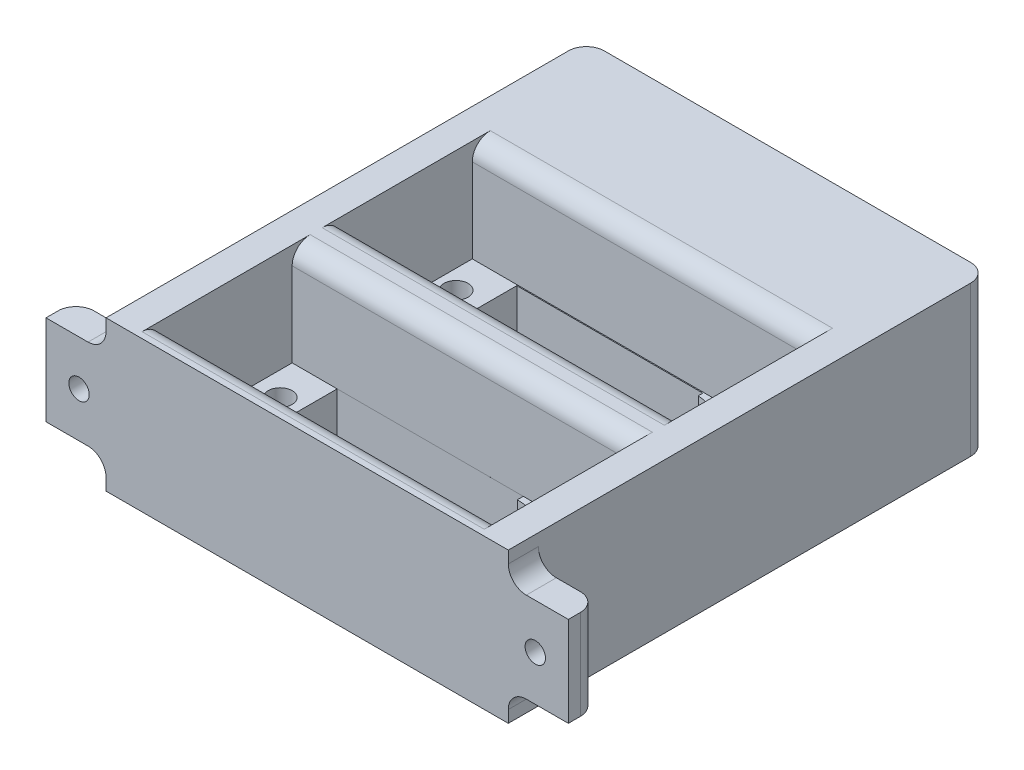
from build123d import *

# Parameters (mm, degrees)
SKETCH1_W           = 67
SKETCH1_H           = 30
BOSS_EXTRUDE1_DEPTH = 25
SKETCH2_W           = 57
SKETCH2_H           = 22
CUT_EXTRUDE1_DEPTH  = 17
SKETCH3_R           = 10
SKETCH3_R_2         = 8
SKETCH3_R_3         = 2
CUT_EXTRUDE2_DEPTH  = 8
BOSS_EXTRUDE2_START = -67
SKETCH4_W           = 5
SKETCH4_H           = 15
BOSS_EXTRUDE2_DEPTH = 10
SKETCH4_2_W         = 5
SKETCH4_2_H         = 15
BOSS_EXTRUDE3_DEPTH = 10
SKETCH5_R           = 1.7
CUT_EXTRUDE3_DEPTH  = 10
CUT_EXTRUDE4_DEPTH  = 8
SKETCH8_W           = 67
SKETCH8_H           = 25
BOSS_EXTRUDE4_DEPTH = 50
SKETCH9_W           = 57
SKETCH9_H           = 22
CUT_EXTRUDE6_DEPTH  = 17
SKETCH11_R          = 10
SKETCH11_R_2        = 8
SKETCH11_R_3        = 2
CUT_EXTRUDE7_DEPTH  = 81.039052968
CUT_EXTRUDE8_DEPTH  = 81.039052968
FILLET1_R           = 3


with BuildPart() as part:
    # Sketch1 → Boss-Extrude1 (new body)
    with BuildSketch(Plane(origin=(0, 0, 0), x_dir=(1, 0, 0), z_dir=(0, 1, 0))):
        Rectangle(SKETCH1_W, SKETCH1_H)
    extrude(amount=BOSS_EXTRUDE1_DEPTH)

    # Sketch2 → Cut-Extrude1 (cut)
    with BuildSketch(Plane(origin=(0, 25, 0), x_dir=(1, 0, 0), z_dir=(0, 1, 0))):
        Rectangle(SKETCH2_W, SKETCH2_H)
    extrude(amount=-CUT_EXTRUDE1_DEPTH, mode=Mode.SUBTRACT)

    # Sketch3 → Cut-Extrude2 (cut)
    with BuildSketch(Plane(origin=(0, 8, 0), x_dir=(1, 0, 0), z_dir=(0, 1, 0))):
        with Locations((10, 0)):
            Circle(SKETCH3_R)
        with Locations((-3, 0)):
            Circle(SKETCH3_R_2)
        with Locations(Location((-24.5, 5, 0), (0, 0, 270))):
            Circle(SKETCH3_R_3)
        with Locations(Location((-24.5, -5, 0), (0, 0, 270))):
            Circle(SKETCH3_R_3)
        with Locations(Location((24.5, 5, 0), (0, 0, 270))):
            Circle(SKETCH3_R_3)
        with Locations(Location((24.5, -5, 0), (0, 0, 270))):
            Circle(SKETCH3_R_3)
    extrude(amount=-CUT_EXTRUDE2_DEPTH, mode=Mode.SUBTRACT)

    # Sketch4 → Boss-Extrude2 (add)
    with BuildSketch(Plane(origin=(33.5, 0, 0), x_dir=(0, 0, -1), z_dir=(1, 0, 0)).offset(BOSS_EXTRUDE2_START)):
        with Locations((-12.5, 12.5)):
            Rectangle(SKETCH4_W, SKETCH4_H)
    extrude(amount=-BOSS_EXTRUDE2_DEPTH)

    # Sketch4<2> → Boss-Extrude3 (add)
    with BuildSketch(Plane(origin=(33.5, 0, 0), x_dir=(0, 0, -1), z_dir=(1, 0, 0))):
        with Locations((-12.5, 12.5)):
            Rectangle(SKETCH4_2_W, SKETCH4_2_H)
    extrude(amount=BOSS_EXTRUDE3_DEPTH)

    # Sketch5 → Cut-Extrude3 (cut)
    with BuildSketch(Plane(origin=(0, 0, 10), x_dir=(-1, 0, 0), z_dir=(0, 0, -1))):
        with Locations(Location((38, 12.5, 0), (0, 0, 90))):
            Circle(SKETCH5_R)
        with Locations(Location((-38, 12.5, 0), (0, 0, 90))):
            Circle(SKETCH5_R)
    extrude(amount=-CUT_EXTRUDE3_DEPTH, mode=Mode.SUBTRACT)

    # Sketch6 → Cut-Extrude4 (cut)
    with BuildSketch(Plane(origin=(0, 8, 0), x_dir=(1, 0, 0), z_dir=(0, 1, 0))):
        Polygon((-21, 11.00455557), (-21.003329437, -10.997477388), (10, -11.002168937), (10, 10.997831063), align=None)
    extrude(amount=-CUT_EXTRUDE4_DEPTH, mode=Mode.SUBTRACT)

    # Sketch8 → Boss-Extrude4 (add)
    with BuildSketch(Plane(origin=(0, 0, -15), x_dir=(-1, 0, 0), z_dir=(0, 0, -1))):
        with Locations((0, 12.5)):
            Rectangle(SKETCH8_W, SKETCH8_H)
    extrude(amount=BOSS_EXTRUDE4_DEPTH)

    # Sketch9 → Cut-Extrude6 (cut)
    with BuildSketch(Plane(origin=(0, 25, 0), x_dir=(1, 0, 0), z_dir=(0, 1, 0))):
        with Locations((0, 30)):
            Rectangle(SKETCH9_W, SKETCH9_H)
    extrude(amount=-CUT_EXTRUDE6_DEPTH, mode=Mode.SUBTRACT)

    # Sketch11 → Cut-Extrude7 (cut, through all)
    with BuildSketch(Plane(origin=(0, 8, 0), x_dir=(1, 0, 0), z_dir=(0, 1, 0))):
        with Locations((9.177125898, 30.121191818)):
            Circle(SKETCH11_R)
        with Locations((-3.822874102, 30.121191818)):
            Circle(SKETCH11_R_2)
        with Locations(Location((-25.322874102, 35.121191818, 0), (0, 0, 270))):
            Circle(SKETCH11_R_3)
        with Locations(Location((-25.322874102, 25.121191818, 0), (0, 0, 270))):
            Circle(SKETCH11_R_3)
        with Locations(Location((23.677125898, 35.121191818, 0), (0, 0, 270))):
            Circle(SKETCH11_R_3)
        with Locations(Location((23.677125898, 25.121191818, 0), (0, 0, 270))):
            Circle(SKETCH11_R_3)
    extrude(amount=-CUT_EXTRUDE7_DEPTH, mode=Mode.SUBTRACT)

    # Sketch13 → Cut-Extrude8 (cut, through all)
    with BuildSketch(Plane(origin=(0, 8, 0), x_dir=(1, 0, 0), z_dir=(0, 1, 0))):
        Polygon((-20.928820676, 40.842619331), (-20.932150113, 18.840586374), (10.071179324, 18.835894824), (10.071179324, 40.835894824), align=None)
    extrude(amount=-CUT_EXTRUDE8_DEPTH, mode=Mode.SUBTRACT)

    # Fillet1
    fillet1_edges = [part.edges().sort_by_distance(p)[0] for p in [
        (0, 25, -41),
        (0, 25, -19),
        (0, 25, 11),
        (-43.5, 12.5, 10),
        (-33.5, 20, 12.5),
        (-33.5, 5, 12.5),
        (0, 25, -11),
        (33.5, 20, 12.5),
        (33.5, 5, 12.5),
        (43.5, 12.5, 10),
        (33.5, 12.5, -65),
        (-33.5, 12.5, -65),
    ]]
    fillet(fillet1_edges, radius=FILLET1_R)


solid = part.part
